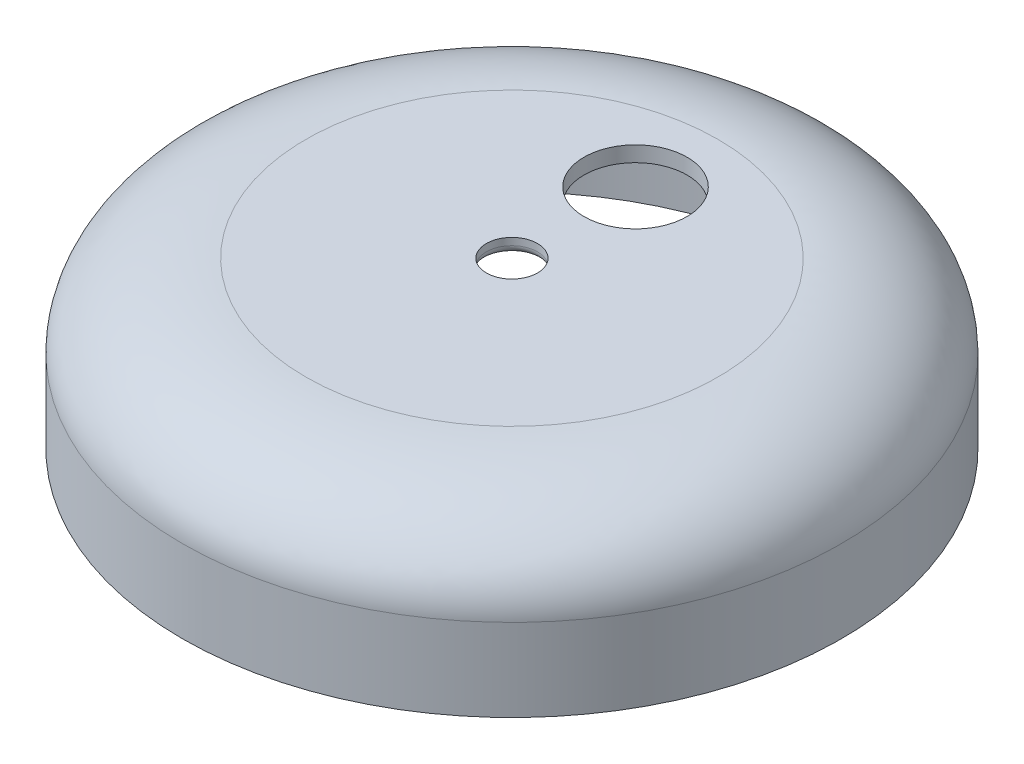
from build123d import *

# Parameters (mm, degrees)
SKETCH2_R          = 15.875
SKETCH2_R_2        = 7.874
CUT_EXTRUDE1_DEPTH = 25.4
FILLET1_R          = 2.54


with BuildPart() as part:
    # Sketch1 → Revolve1 (revolve)
    with BuildSketch(Plane.XY, mode=Mode.PRIVATE) as revolve1_sk:
        with BuildLine():
            Line((0, 0), (0, -4.7625))
            Line((0, -4.7625), (63.5, -4.7625))
            add(Edge.make_bspline(
                [(96.8375, -25.4), (96.8375, -4.7625), (63.5, -4.7625)],
                knots=[0, 0, 0, 1.570796327, 1.570796327, 1.570796327], degree=2, weights=[1, 0.707106781, 1]))
            Line((96.8375, -25.4), (96.8375, -50.8))
            Line((96.8375, -50.8), (101.6, -50.8))
            Line((101.6, -50.8), (101.6, -25.4))
            add(Edge.make_bspline(
                [(101.6, -25.4), (101.6, 0), (63.5, 0)],
                knots=[3.141592654, 3.141592654, 3.141592654, 4.71238898, 4.71238898, 4.71238898], degree=2, weights=[1, 0.707106781, 1]))
            Line((63.5, 0), (0, 0))
        make_face()
    revolve(revolve1_sk.sketch.rotate(Axis((0, 29.511089747, 0), (0, -1, 0)), 90), axis=Axis((0, 29.511089747, 0), (0, -1, 0)))

    # Sketch2 → Cut-Extrude1 (cut)
    with BuildSketch(Plane(origin=(0, 0, 0), x_dir=(1, 0, 0), z_dir=(0, 1, 0))):
        with Locations(Location((0, 38.1, 0), (0, 0, 270))):
            Circle(SKETCH2_R)
        with Locations(Location((0, 0, 0), (0, 0, 270))):
            Circle(SKETCH2_R_2)
    extrude(amount=-CUT_EXTRUDE1_DEPTH, mode=Mode.SUBTRACT)

    # Fillet1
    fillet1_edges = [part.edges().sort_by_distance(p)[0] for p in [
        (0, -4.7625, -7.874),
    ]]
    fillet(fillet1_edges, radius=FILLET1_R)


solid = part.part
